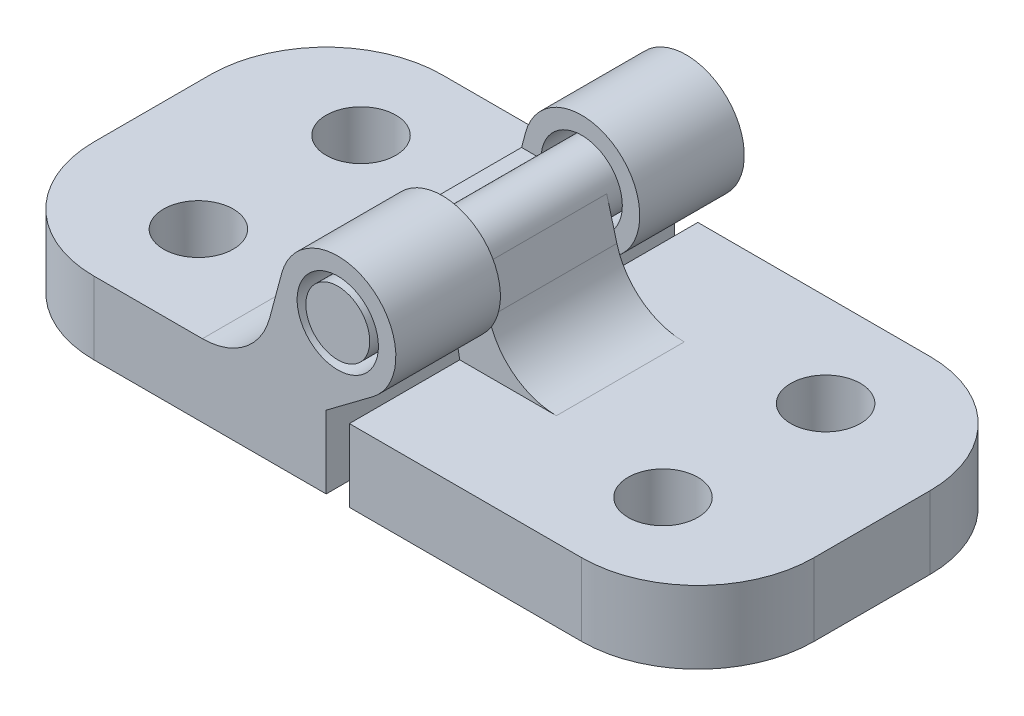
from build123d import *

# Parameters (mm, degrees)
SKETCH2_W                = 15
SKETCH2_H                = 15
BOSS_EXTRUDE1_DEPTH      = 3.125
BOSS_EXTRUDE1_2_DEPTH    = 3.125
SKETCH3_R                = 1.75
BOSS_EXTRUDE2_DEPTH      = 15
SKETCH4_W                = 6
SKETCH4_H                = 5.75
CUT_EXTRUDE1_DEPTH       = 2.5
CUT_EXTRUDE4_REACH       = 21.488
SKETCH9_W                = 6
SKETCH9_H                = 2.5
BOSS_EXTRUDE3_DEPTH      = 2.75
BOSS_EXTRUDE3_DEPTH_BACK = 2.75
BOSS_EXTRUDE4_START      = -7.5
SKETCH7_R                = 1.375
BOSS_EXTRUDE4_DEPTH      = 15
SKETCH8_R                = 1.5
CUT_EXTRUDE2_DEPTH       = 3.125
FILLET1_R                = 5
FILLET2_R                = 5
FILLET3_R                = 3
FILLET4_R                = 3


with BuildPart() as part:
    # Sketch2 → Boss-Extrude1 (new body)
    with BuildSketch(Plane(origin=(0, 0, 0), x_dir=(1, 0, 0), z_dir=(0, 1, 0))):
        with Locations((-8, 0)):
            Rectangle(SKETCH2_W, SKETCH2_H)
    extrude(amount=BOSS_EXTRUDE1_DEPTH)

    # Sketch3 → Boss-Extrude2 (add)
    with BuildSketch(Plane.XY.offset(7.5)):
        with BuildLine():
            Line((-0.5, 3.125), (1.5, 4.625))
            ThreePointArc((1.5, 4.625), (1.400334, 8.696005), (-2.414815, 7.272048))
            Line((-2.414815, 7.272048), (-3.526013, 3.125))
            Line((-3.526013, 3.125), (-0.5, 3.125))
        make_face()
        with Locations((0, 6.625)):
            Circle(SKETCH3_R, mode=Mode.SUBTRACT)
    extrude(amount=-BOSS_EXTRUDE2_DEPTH)

    # Sketch4 → Cut-Extrude1 (cut)
    with BuildSketch(Plane(origin=(0, 0, 0), x_dir=(0, 0, -1), z_dir=(1, 0, 0))):
        with Locations((0, 6.25)):
            Rectangle(SKETCH4_W, SKETCH4_H)
    extrude(amount=CUT_EXTRUDE1_DEPTH, mode=Mode.SUBTRACT)

    # Cut-Extrude4: up to this plane
    cut_extrude4_end = Plane(origin=(-2.414815, 7.272048, -16.003695), z_dir=(-0.9659258262890672, 0.25881904510252496, 0))
    # Sketch9 → Cut-Extrude4 (cut, up to the surface)
    with BuildSketch(Plane(origin=(0, 0, 0), x_dir=(0, 0, -1), z_dir=(1, 0, 0)), mode=Mode.PRIVATE) as cut_extrude4_sk1:
        with Locations((0, 7.875)):
            Rectangle(SKETCH9_W, SKETCH9_H)
    cut_extrude4_tool1 = split(extrude(cut_extrude4_sk1.sketch, amount=-CUT_EXTRUDE4_REACH, mode=Mode.PRIVATE), bisect_by=cut_extrude4_end, keep=Keep.BOTH, mode=Mode.PRIVATE)
    add(cut_extrude4_tool1.solids().sort_by_distance((0, 7.875, 0))[0], mode=Mode.SUBTRACT)


with BuildPart() as body_2:
    # Sketch2 → Boss-Extrude1 2 (new body)
    with BuildSketch(Plane(origin=(0, 0, 0), x_dir=(1, 0, 0), z_dir=(0, 1, 0))):
        with Locations((8, 0)):
            Rectangle(SKETCH2_W, SKETCH2_H)
    extrude(amount=BOSS_EXTRUDE1_2_DEPTH)

    # Sketch5 → Boss-Extrude3 (add, two sides: drawn at the far end of the back side and taken through both)
    with BuildSketch(Plane.XY.offset(-BOSS_EXTRUDE3_DEPTH_BACK)):
        with BuildLine():
            Line((0.124312, 5.255631), (0.5, 3.125))
            Line((0.5, 3.125), (2.361327, 3.125))
            Line((2.361327, 3.125), (1.328148, 6.980876))
            ThreePointArc((1.328148, 6.980876), (-1.12762, 7.411827), (0.124312, 5.255631))
        make_face()
    extrude(amount=BOSS_EXTRUDE3_DEPTH + BOSS_EXTRUDE3_DEPTH_BACK)

    # Sketch7 → Boss-Extrude4 (add)
    with BuildSketch(Plane.XY.offset(BOSS_EXTRUDE4_START)):
        with Locations(Location((0, 6.625, 0), (0, 0, 180))):
            Circle(SKETCH7_R)
    extrude(amount=BOSS_EXTRUDE4_DEPTH)


with BuildPart() as cut_extrude2_tool:
    # Sketch8 → Cut-Extrude2 (new body)
    with BuildSketch(Plane(origin=(0, 3.125, 0), x_dir=(1, 0, 0), z_dir=(0, 1, 0))):
        with Locations(Location((-10, 3.5, 0), (0, 0, 270))):
            Circle(SKETCH8_R)
        with Locations(Location((-10, -3.5, 0), (0, 0, 270))):
            Circle(SKETCH8_R)
        with Locations(Location((10, -3.5, 0), (0, 0, 270))):
            Circle(SKETCH8_R)
        with Locations(Location((10, 3.5, 0), (0, 0, 270))):
            Circle(SKETCH8_R)
    extrude(amount=-CUT_EXTRUDE2_DEPTH)


with BuildPart() as part_1:
    add(part.part)

    # Cut-Extrude2: cut by cut_extrude2_tool
    add(cut_extrude2_tool.part, mode=Mode.SUBTRACT)

    # Fillet1
    fillet1_edges = [part_1.edges().sort_by_distance(p)[0] for p in [
        (-15.5, 1.5625, 7.5),
        (-15.5, 1.5625, -7.5),
    ]]
    fillet(fillet1_edges, radius=FILLET1_R)

    # Fillet3
    fillet3_edges = [part_1.edges().sort_by_distance(p)[0] for p in [
        (-3.526013, 3.125, 0),
    ]]
    fillet(fillet3_edges, radius=FILLET3_R)


with BuildPart() as body_2_1:
    add(body_2.part)

    # Cut-Extrude2: cut by cut_extrude2_tool
    add(cut_extrude2_tool.part, mode=Mode.SUBTRACT)

    # Fillet2
    fillet2_edges = [body_2_1.edges().sort_by_distance(p)[0] for p in [
        (15.5, 1.5625, 7.5),
        (15.5, 1.5625, -7.5),
    ]]
    fillet(fillet2_edges, radius=FILLET2_R)

    # Fillet4
    fillet4_edges = [body_2_1.edges().sort_by_distance(p)[0] for p in [
        (2.361327, 3.125, 0),
    ]]
    fillet(fillet4_edges, radius=FILLET4_R)


solid = Compound([part_1.part, body_2_1.part])
